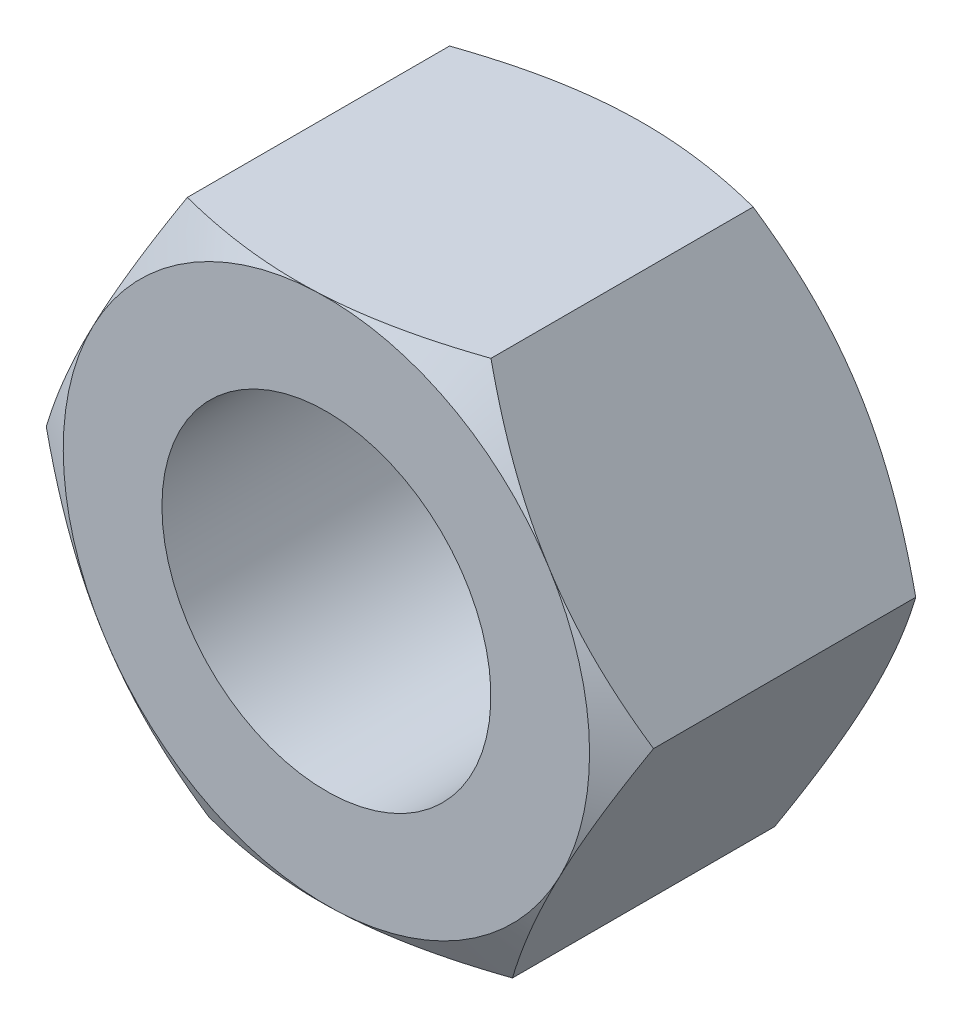
from build123d import *

# Parameters (mm, degrees)
BOSS_EXTRUDE1_DEPTH = 4.7
SKETCH2_OUTSIDE_W   = 30.152
SKETCH2_OUTSIDE_H   = 29.104
SKETCH2_OUTSIDE_R   = 4
CUT_EXTRUDE1_DEPTH  = 4.7
CUT_EXTRUDE1_DRAFT  = -60
SKETCH3_OUTSIDE_W   = 30.152
SKETCH3_OUTSIDE_H   = 29.104
SKETCH3_OUTSIDE_R   = 4
CUT_EXTRUDE2_DEPTH  = 4.7
CUT_EXTRUDE2_DRAFT  = -60
SKETCH4_R           = 2.5
CUT_EXTRUDE3_DEPTH  = 8.753992561


with BuildPart() as part:
    # Sketch1 → Boss-Extrude1 (new body)
    with BuildSketch(Plane.XY):
        Polygon((2.143973942, 4.091052318), (-2.470968265, 3.902262058), (-4.614942207, -0.18879026), (-2.143973942, -4.091052318), (2.470968265, -3.902262058), (4.614942207, 0.18879026), align=None)
    extrude(amount=BOSS_EXTRUDE1_DEPTH)


with BuildPart() as cut_extrude1_tool:
    # Sketch2 outside → Cut-Extrude1 (with draft: the straight prism first)
    with BuildSketch(Plane.XY.offset(4.7)):
        Rectangle(SKETCH2_OUTSIDE_W, SKETCH2_OUTSIDE_H)
        Circle(SKETCH2_OUTSIDE_R, mode=Mode.SUBTRACT)
    extrude(amount=-CUT_EXTRUDE1_DEPTH)
    # Cut-Extrude1: the draft: its side faces are tilted about the plane it starts from
    cut_extrude1_sides = [cut_extrude1_tool.faces().sort_by_distance(p)[0] for p in [
        (0, -14.552, 2.35),
        (15.076, 0, 2.35),
        (0, 14.552, 2.35),
        (-15.076, 0, 2.35),
        (-4, 0, 2.35),
    ]]
    draft(cut_extrude1_sides, Plane.XY.offset(4.7), CUT_EXTRUDE1_DRAFT)


with BuildPart() as part_1:
    add(part.part)

    # Cut-Extrude1: cut by cut_extrude1_tool
    add(cut_extrude1_tool.part, mode=Mode.SUBTRACT)


with BuildPart() as cut_extrude2_tool:
    # Sketch3 outside → Cut-Extrude2 (with draft: the straight prism first)
    with BuildSketch(Plane(origin=(0, 0, 0), x_dir=(-1, 0, 0), z_dir=(0, 0, -1))):
        Rectangle(SKETCH3_OUTSIDE_W, SKETCH3_OUTSIDE_H)
        Circle(SKETCH3_OUTSIDE_R, mode=Mode.SUBTRACT)
    extrude(amount=-CUT_EXTRUDE2_DEPTH)
    # Cut-Extrude2: the draft: its side faces are tilted about the plane it starts from
    cut_extrude2_sides = [cut_extrude2_tool.faces().sort_by_distance(p)[0] for p in [
        (0, -14.552, 2.35),
        (-15.076, 0, 2.35),
        (0, 14.552, 2.35),
        (15.076, 0, 2.35),
        (4, 0, 2.35),
    ]]
    draft(cut_extrude2_sides, Plane(origin=(0, 0, 0), x_dir=(-1, 0, 0), z_dir=(0, 0, -1)), CUT_EXTRUDE2_DRAFT)


with BuildPart() as part_2:
    add(part_1.part)

    # Cut-Extrude2: cut by cut_extrude2_tool
    add(cut_extrude2_tool.part, mode=Mode.SUBTRACT)

    # Sketch4 → Cut-Extrude3 (cut, through all)
    with BuildSketch(Plane(origin=(0, 0, 0), x_dir=(-1, 0, 0), z_dir=(0, 0, -1))):
        Circle(SKETCH4_R)
    extrude(amount=-CUT_EXTRUDE3_DEPTH, mode=Mode.SUBTRACT)


solid = part_2.part
